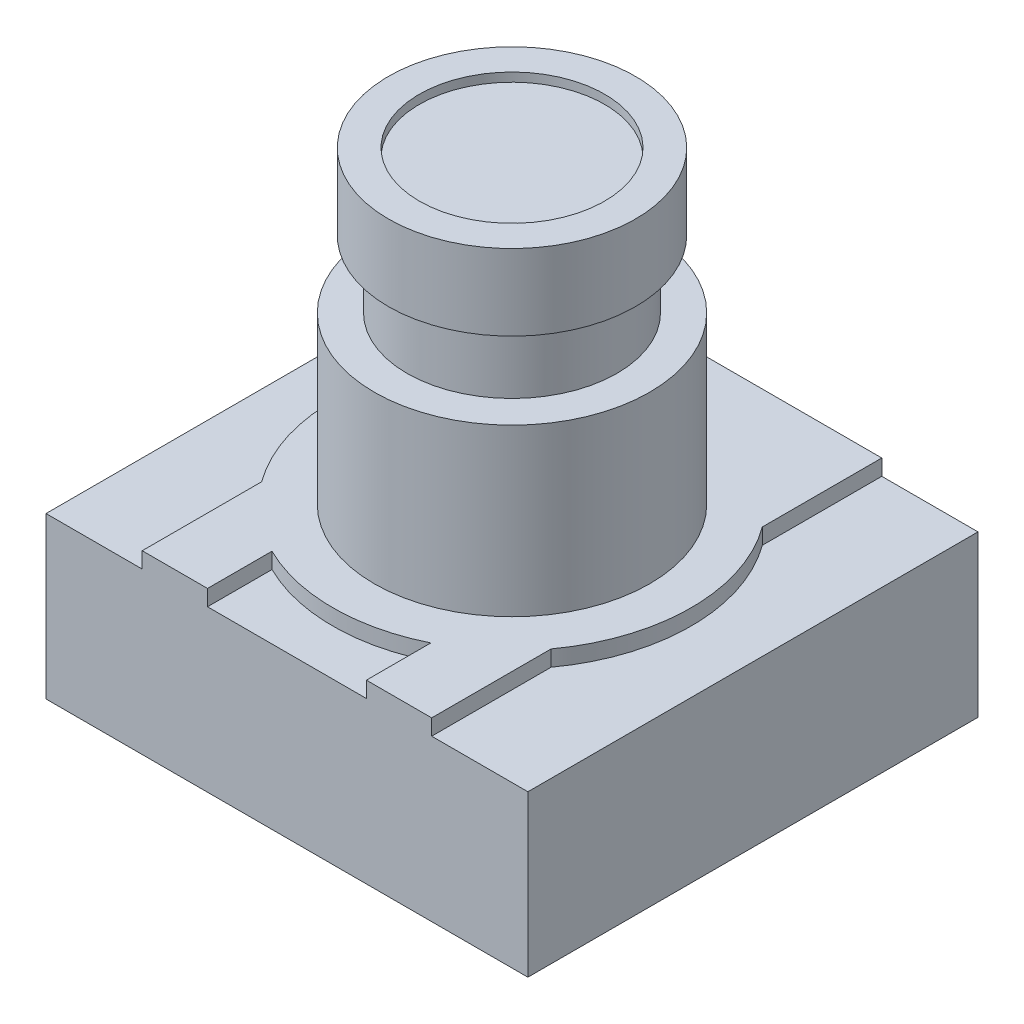
from build123d import *

# Parameters (mm, degrees)
SKETCH1_W           = 27.3
SKETCH1_H           = 25.5
BOSS_EXTRUDE1_DEPTH = 10
CUT_EXTRUDE1_DEPTH  = 0.9
SKETCH3_R           = 7.8
BOSS_EXTRUDE2_DEPTH = 9.4
SKETCH4_R           = 5.95
BOSS_EXTRUDE3_DEPTH = 3.8
SKETCH5_R           = 7
BOSS_EXTRUDE4_DEPTH = 4.3
SKETCH6_R           = 5.25
CUT_EXTRUDE2_DEPTH  = 0.5
SKETCH7_W           = 6.9
SKETCH7_H           = 3.2
BOSS_EXTRUDE5_DEPTH = 1.1
SKETCH8_W           = 5.9
SKETCH8_H           = 2.7
CUT_EXTRUDE3_DEPTH  = 2.5


with BuildPart() as part:
    # Sketch1 → Boss-Extrude1 (new body)
    with BuildSketch(Plane(origin=(0, 0, 0), x_dir=(1, 0, 0), z_dir=(0, 1, 0))):
        Rectangle(SKETCH1_W, SKETCH1_H)
    extrude(amount=BOSS_EXTRUDE1_DEPTH)

    # Sketch2 → Cut-Extrude1 (cut)
    with BuildSketch(Plane(origin=(0, 10, 0), x_dir=(1, 0, 0), z_dir=(0, 1, 0))):
        with BuildLine():
            Line((-8.2, 5.981847541), (-8.2, 12.75))
            Line((-8.2, 12.75), (-13.65, 12.75))
            Line((-13.65, 12.75), (-13.65, -12.75))
            Line((-13.65, -12.75), (-8.2, -12.75))
            Line((-8.2, -12.75), (-8.2, -5.981847541))
            ThreePointArc((-8.2, -5.981847541), (-10.15, 0), (-8.2, 5.981847541))
        make_face()
        with BuildLine():
            Line((13.65, 12.75), (8.2, 12.75))
            Line((8.2, 12.75), (8.2, 5.981847541))
            ThreePointArc((8.2, 5.981847541), (9.650194299, 3.145830574), (10.15, 0))
            ThreePointArc((10.15, 0), (9.650194299, -3.145830574), (8.2, -5.981847541))
            Line((8.2, -5.981847541), (8.2, -12.75))
            Line((8.2, -12.75), (13.65, -12.75))
            Line((13.65, -12.75), (13.65, 12.75))
        make_face()
        with BuildLine():
            ThreePointArc((0, -10.15), (-2.310672611, -9.883485827), (-4.5, -9.097939327))
            Line((-4.5, -9.097939327), (-4.5, -12.75))
            Line((-4.5, -12.75), (0, -12.75))
            Line((0, -12.75), (0, -10.15))
        make_face()
        with BuildLine():
            ThreePointArc((4.5, -9.097939327), (2.310672611, -9.883485827), (0, -10.15))
            Line((0, -10.15), (0, -12.75))
            Line((0, -12.75), (4.5, -12.75))
            Line((4.5, -12.75), (4.5, -9.097939327))
        make_face()
    extrude(amount=-CUT_EXTRUDE1_DEPTH, mode=Mode.SUBTRACT)

    # Sketch3 → Boss-Extrude2 (add)
    with BuildSketch(Plane(origin=(0, 10, 0), x_dir=(1, 0, 0), z_dir=(0, 1, 0))):
        with Locations(Location((0, 0, 0), (0, 0, 270))):
            Circle(SKETCH3_R)
    extrude(amount=BOSS_EXTRUDE2_DEPTH)

    # Sketch4 → Boss-Extrude3 (add)
    with BuildSketch(Plane(origin=(0, 19.4, 0), x_dir=(1, 0, 0), z_dir=(0, 1, 0))):
        with Locations(Location((0, 0, 0), (0, 0, 90))):
            Circle(SKETCH4_R)
    extrude(amount=BOSS_EXTRUDE3_DEPTH)

    # Sketch5 → Boss-Extrude4 (add)
    with BuildSketch(Plane(origin=(0, 23.2, 0), x_dir=(1, 0, 0), z_dir=(0, 1, 0))):
        with Locations(Location((0, 0, 0), (0, 0, 270))):
            Circle(SKETCH5_R)
    extrude(amount=BOSS_EXTRUDE4_DEPTH)

    # Sketch6 → Cut-Extrude2 (cut)
    with BuildSketch(Plane(origin=(0, 27.5, 0), x_dir=(1, 0, 0), z_dir=(0, 1, 0))):
        with Locations(Location((0, 0, 0), (0, 0, 270))):
            Circle(SKETCH6_R)
    extrude(amount=-CUT_EXTRUDE2_DEPTH, mode=Mode.SUBTRACT)

    # Sketch7 → Boss-Extrude5 (add)
    with BuildSketch(Plane.XZ):
        with Locations((0, 9.65)):
            Rectangle(SKETCH7_W, SKETCH7_H)
    extrude(amount=BOSS_EXTRUDE5_DEPTH)

    # Sketch8 → Cut-Extrude3 (cut)
    with BuildSketch(Plane.XZ.offset(1.1)):
        with Locations((0, 9.4)):
            Rectangle(SKETCH8_W, SKETCH8_H)
    extrude(amount=-CUT_EXTRUDE3_DEPTH, mode=Mode.SUBTRACT)


solid = part.part
